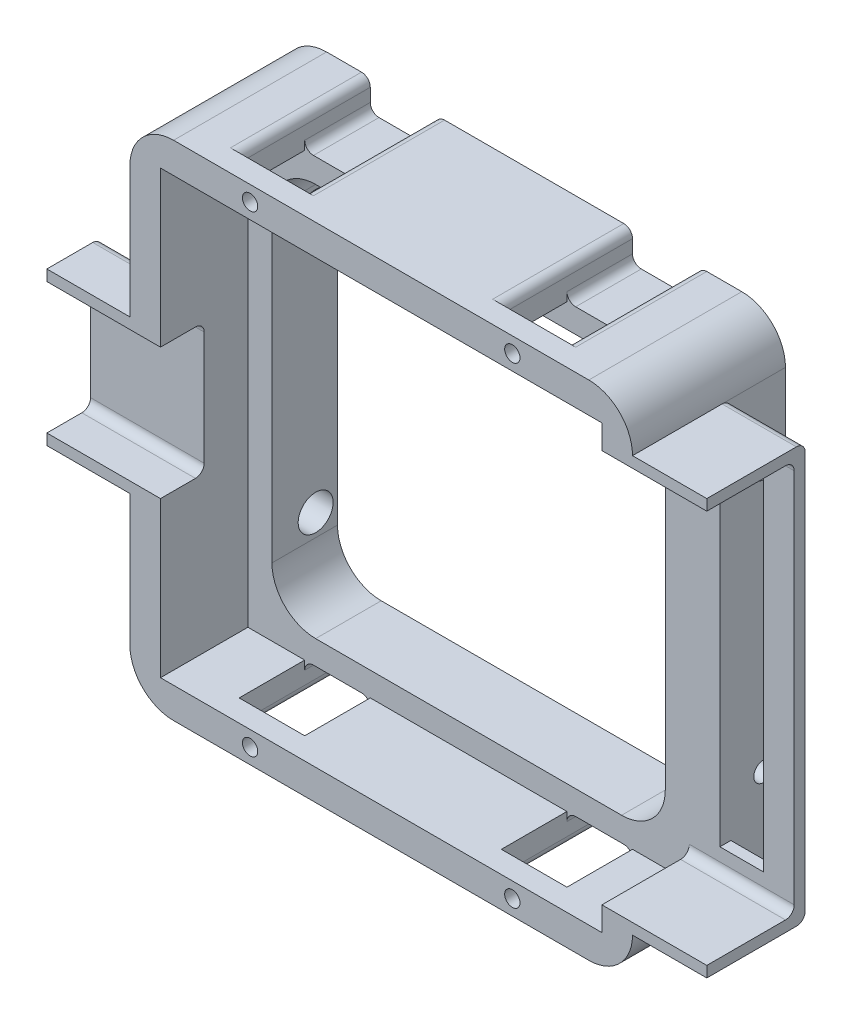
from build123d import *

# Parameters (mm, degrees)
SKETCH1_W                                  = 115
SKETCH1_H                                  = 115
BOSS_EXTRUDE1_DEPTH                        = 30
FILLET1_R                                  = 10
SKETCH4_W                                  = 101
SKETCH4_H                                  = 101
CUT_EXTRUDE3_DEPTH                         = 20
SKETCH7_W                                  = 90
SKETCH7_H                                  = 90
CUT_EXTRUDE5_DEPTH                         = 60
FILLET3_R                                  = 10
SKETCH8_R                                  = 3.15
CUT_EXTRUDE6_DEPTH                         = 35
MIRROR2_AT_THE_SECOND_PLANE_COPY_1_SKETC_R = 3.15
MIRROR2_AT_THE_SECOND_PLANE_COPY_1_DEPTH   = 35
SKETCH11_W                                 = 40
SKETCH11_H                                 = 90
CUT_EXTRUDE9_DEPTH                         = 11
SKETCH13_W                                 = 2.5
SKETCH13_H                                 = 90
BOSS_EXTRUDE2_DEPTH                        = 17
FILLET6_R                                  = 2
SKETCH14_W                                 = 20
SKETCH14_H                                 = 30
CUT_EXTRUDE10_DEPTH                        = 11
SKETCH15_W                                 = 10
SKETCH15_H                                 = 2.5
BOSS_EXTRUDE3_DEPTH                        = 19
FILLET7_R                                  = 2
SKETCH16_W                                 = 115
SKETCH16_H                                 = 115
CUT_EXTRUDE12_DEPTH                        = 25
SKETCH17_W                                 = 10
SKETCH17_H                                 = 80
CUT_EXTRUDE13_DEPTH                        = 15
SKETCH20_R                                 = 2.25
CUT_EXTRUDE14_DEPTH                        = 25
MIRROR8_AT_THE_SECOND_PLANE_COPY_1_SKETC_R = 2.25
MIRROR8_AT_THE_SECOND_PLANE_COPY_1_DEPTH   = 25
SKETCH21_R                                 = 1.75
CUT_EXTRUDE15_DEPTH                        = 20
MIRROR9_AT_THE_SECOND_PLANE_COPY_1_SKETC_R = 1.75
MIRROR9_AT_THE_SECOND_PLANE_COPY_1_DEPTH   = 20
SKETCH24_W                                 = 15
SKETCH24_H                                 = 25
CUT_EXTRUDE16_DEPTH                        = 7
MIRROR10_AT_THE_SECOND_PLANE_COPY_1_SKET_W = 15
MIRROR10_AT_THE_SECOND_PLANE_COPY_1_SKET_H = 25
MIRROR10_AT_THE_SECOND_PLANE_COPY_1_DEPTH  = 7
SKETCH25_R                                 = 4
CUT_EXTRUDE17_DEPTH                        = 7.5
MIRROR11_AT_THE_SECOND_PLANE_COPY_1_SKET_R = 4
MIRROR11_AT_THE_SECOND_PLANE_COPY_1_DEPTH  = 7.5
SKETCH28_W                                 = 15
SKETCH28_H                                 = 14
CUT_EXTRUDE20_DEPTH                        = 20
MIRROR12_AT_THE_SECOND_PLANE_COPY_1_SKET_W = 15
MIRROR12_AT_THE_SECOND_PLANE_COPY_1_SKET_H = 14
MIRROR12_AT_THE_SECOND_PLANE_COPY_1_DEPTH  = 20
FILLET8_R                                  = 2


with BuildPart() as part:
    # Sketch1 → Boss-Extrude1 (new, symmetric)
    with BuildSketch(Plane.XY):
        Rectangle(SKETCH1_W, SKETCH1_H)
    extrude(amount=BOSS_EXTRUDE1_DEPTH, both=True)

    # Fillet1
    fillet1_edges = [part.edges().sort_by_distance(p)[0] for p in [
        (-57.5, 57.5, 0),
        (57.5, 57.5, 0),
        (57.5, -57.5, 0),
        (-57.5, -57.5, 0),
    ]]
    fillet(fillet1_edges, radius=FILLET1_R)

    # Sketch4 → Cut-Extrude3 (cut)
    with BuildSketch(Plane.XY.offset(30)):
        Rectangle(SKETCH4_W, SKETCH4_H)
    extrude(amount=-CUT_EXTRUDE3_DEPTH, mode=Mode.SUBTRACT)

    # Sketch7 → Cut-Extrude5 (cut)
    with BuildSketch(Plane.XY.offset(10)):
        Rectangle(SKETCH7_W, SKETCH7_H)
    extrude(amount=-CUT_EXTRUDE5_DEPTH, mode=Mode.SUBTRACT)

    # Fillet3
    fillet3_edges = [part.edges().sort_by_distance(p)[0] for p in [
        (-45, -45, -10),
        (-45, 45, -10),
        (45, 45, -10),
        (45, -45, -10),
    ]]
    fillet(fillet3_edges, radius=FILLET3_R)

    # Sketch8 → Cut-Extrude6 (cut)
    with BuildSketch(Plane(origin=(0, 0, -30), x_dir=(-1, 0, 0), z_dir=(0, 0, -1))):
        with Locations((-48, 48)):
            Circle(SKETCH8_R)
    cut_extrude6 = extrude(amount=-CUT_EXTRUDE6_DEPTH, mode=Mode.SUBTRACT)

    # Mirror2: Cut-Extrude6 across plane
    add(cut_extrude6.mirror(Plane.ZX), mode=Mode.SUBTRACT)

    # Mirror2 at the second plane: Cut-Extrude6 across plane
    add(cut_extrude6.mirror(Plane(origin=(0, 0, 0), x_dir=(0, 0, 1), z_dir=(1, 0, 0))), mode=Mode.SUBTRACT)

    # Mirror2 at the second plane copy 1 sketc → Mirror2 at the second plane copy 1 (cut)
    with BuildSketch(Plane(origin=(0, 0, -30), x_dir=(1, 0, 0), z_dir=(0, 0, -1))):
        with Locations((-48, 48)):
            Circle(MIRROR2_AT_THE_SECOND_PLANE_COPY_1_SKETC_R)
    extrude(amount=-MIRROR2_AT_THE_SECOND_PLANE_COPY_1_DEPTH, mode=Mode.SUBTRACT)

    # Sketch11 → Cut-Extrude9 (cut)
    with BuildSketch(Plane(origin=(57.5, 0, 0), x_dir=(0, 0, -1), z_dir=(1, 0, 0))):
        with Locations((-30, 0)):
            Rectangle(SKETCH11_W, SKETCH11_H)
    extrude(amount=-CUT_EXTRUDE9_DEPTH, mode=Mode.SUBTRACT)

    # Sketch13 → Boss-Extrude2 (add)
    with BuildSketch(Plane(origin=(57.5, 0, 0), x_dir=(0, 0, -1), z_dir=(1, 0, 0))):
        with Locations((-8.75, 0)):
            Rectangle(SKETCH13_W, SKETCH13_H)
        Polygon((-7.5, -45), (-10, -45), (-30, -45), (-30, -47.5), (-7.5, -47.5), align=None)
        Polygon((-30, 45), (-10, 45), (-7.5, 45), (-7.5, 47.5), (-30, 47.5), align=None)
    extrude(amount=BOSS_EXTRUDE2_DEPTH)

    # Fillet6
    fillet6_edges = [part.edges().sort_by_distance(p)[0] for p in [
        (62.5, 45, 10),
        (62.5, -45, 10),
        (66, -47.5, 7.5),
        (66, 47.5, 7.5),
    ]]
    fillet(fillet6_edges, radius=FILLET6_R)

    # Sketch14 → Cut-Extrude10 (cut)
    with BuildSketch(Plane.ZY.offset(57.5)):
        with Locations((30, 0)):
            Rectangle(SKETCH14_W, SKETCH14_H)
    extrude(amount=-CUT_EXTRUDE10_DEPTH, mode=Mode.SUBTRACT)

    # Sketch15 → Boss-Extrude3 (add)
    with BuildSketch(Plane.ZY.offset(57.5)):
        Polygon((20, -15), (20, 15), (20, 17.5), (17.5, 17.5), (17.5, -17.5), (20, -17.5), align=None)
        with Locations((25, 16.25)):
            Rectangle(SKETCH15_W, SKETCH15_H)
        with Locations((25, -16.25)):
            Rectangle(SKETCH15_W, SKETCH15_H)
    extrude(amount=BOSS_EXTRUDE3_DEPTH)

    # Fillet7
    fillet7_edges = [part.edges().sort_by_distance(p)[0] for p in [
        (-63.5, -15, 20),
        (-63.5, 15, 20),
        (-67, 17.5, 17.5),
        (-67, -17.5, 17.5),
    ]]
    fillet(fillet7_edges, radius=FILLET7_R)

    # Sketch16 → Cut-Extrude12 (cut)
    with BuildSketch(Plane(origin=(0, 0, -30), x_dir=(-1, 0, 0), z_dir=(0, 0, -1))):
        Rectangle(SKETCH16_W, SKETCH16_H)
    extrude(amount=-CUT_EXTRUDE12_DEPTH, mode=Mode.SUBTRACT)

    # Sketch17 → Cut-Extrude13 (cut)
    with BuildSketch(Plane(origin=(0, 0, 7.5), x_dir=(-1, 0, 0), z_dir=(0, 0, -1))):
        with Locations((-62.5, 0)):
            Rectangle(SKETCH17_W, SKETCH17_H)
    extrude(amount=-CUT_EXTRUDE13_DEPTH, mode=Mode.SUBTRACT)

    # Sketch20 → Cut-Extrude14 (cut)
    with BuildSketch(Plane(origin=(57.5, 0, 0), x_dir=(0, 0, -1), z_dir=(1, 0, 0))):
        with Locations((0, 30)):
            Circle(SKETCH20_R)
    cut_extrude14 = extrude(amount=-CUT_EXTRUDE14_DEPTH, mode=Mode.SUBTRACT)

    # Mirror8: Cut-Extrude14 across plane
    add(cut_extrude14.mirror(Plane(origin=(0, 0, 0), x_dir=(0, 0, 1), z_dir=(1, 0, 0))), mode=Mode.SUBTRACT)

    # Mirror8 at the second plane: Cut-Extrude14 across plane
    add(cut_extrude14.mirror(Plane.ZX), mode=Mode.SUBTRACT)

    # Mirror8 at the second plane copy 1 sketc → Mirror8 at the second plane copy 1 (cut)
    with BuildSketch(Plane(origin=(-57.5, 0, 0), x_dir=(0, 0, -1), z_dir=(-1, 0, 0))):
        with Locations((0, 30)):
            Circle(MIRROR8_AT_THE_SECOND_PLANE_COPY_1_SKETC_R)
    extrude(amount=-MIRROR8_AT_THE_SECOND_PLANE_COPY_1_DEPTH, mode=Mode.SUBTRACT)

    # Sketch21 → Cut-Extrude15 (cut)
    with BuildSketch(Plane.XY.offset(30)):
        with Locations((30, 54)):
            Circle(SKETCH21_R)
    cut_extrude15 = extrude(amount=-CUT_EXTRUDE15_DEPTH, mode=Mode.SUBTRACT)

    # Mirror9: Cut-Extrude15 across plane
    add(cut_extrude15.mirror(Plane.ZX), mode=Mode.SUBTRACT)

    # Mirror9 at the second plane: Cut-Extrude15 across plane
    add(cut_extrude15.mirror(Plane(origin=(0, 0, 0), x_dir=(0, 0, 1), z_dir=(1, 0, 0))), mode=Mode.SUBTRACT)

    # Mirror9 at the second plane copy 1 sketc → Mirror9 at the second plane copy 1 (cut)
    with BuildSketch(Plane(origin=(0, 0, 30), x_dir=(-1, 0, 0), z_dir=(0, 0, 1))):
        with Locations((30, 54)):
            Circle(MIRROR9_AT_THE_SECOND_PLANE_COPY_1_SKETC_R)
    extrude(amount=-MIRROR9_AT_THE_SECOND_PLANE_COPY_1_DEPTH, mode=Mode.SUBTRACT)

    # Sketch24 → Cut-Extrude16 (cut)
    with BuildSketch(Plane(origin=(0, 57.5, 0), x_dir=(1, 0, 0), z_dir=(0, 1, 0))):
        with Locations((30, -12.5)):
            Rectangle(SKETCH24_W, SKETCH24_H)
    cut_extrude16 = extrude(amount=-CUT_EXTRUDE16_DEPTH, mode=Mode.SUBTRACT)

    # Mirror10: Cut-Extrude16 across plane
    add(cut_extrude16.mirror(Plane(origin=(0, 0, 0), x_dir=(0, 0, 1), z_dir=(1, 0, 0))), mode=Mode.SUBTRACT)

    # Mirror10 at the second plane: Cut-Extrude16 across plane
    add(cut_extrude16.mirror(Plane.ZX), mode=Mode.SUBTRACT)

    # Mirror10 at the second plane copy 1 sket → Mirror10 at the second plane copy 1 (cut)
    with BuildSketch(Plane(origin=(0, -57.5, 0), x_dir=(-1, 0, 0), z_dir=(0, -1, 0))):
        with Locations((30, -12.5)):
            Rectangle(MIRROR10_AT_THE_SECOND_PLANE_COPY_1_SKET_W, MIRROR10_AT_THE_SECOND_PLANE_COPY_1_SKET_H)
    extrude(amount=-MIRROR10_AT_THE_SECOND_PLANE_COPY_1_DEPTH, mode=Mode.SUBTRACT)

    # Sketch25 → Cut-Extrude17 (cut)
    with BuildSketch(Plane.ZY.offset(-45)):
        with Locations((0, 30)):
            Circle(SKETCH25_R)
    cut_extrude17 = extrude(amount=-CUT_EXTRUDE17_DEPTH, mode=Mode.SUBTRACT)

    # Mirror11: Cut-Extrude17 across plane
    add(cut_extrude17.mirror(Plane.ZX), mode=Mode.SUBTRACT)

    # Mirror11 at the second plane: Cut-Extrude17 across plane
    add(cut_extrude17.mirror(Plane(origin=(0, 0, 0), x_dir=(0, 0, 1), z_dir=(1, 0, 0))), mode=Mode.SUBTRACT)

    # Mirror11 at the second plane copy 1 sket → Mirror11 at the second plane copy 1 (cut)
    with BuildSketch(Plane(origin=(-45, 0, 0), x_dir=(0, 0, 1), z_dir=(1, 0, 0))):
        with Locations((0, 30)):
            Circle(MIRROR11_AT_THE_SECOND_PLANE_COPY_1_SKET_R)
    extrude(amount=-MIRROR11_AT_THE_SECOND_PLANE_COPY_1_DEPTH, mode=Mode.SUBTRACT)

    # Sketch28 → Cut-Extrude20 (cut)
    with BuildSketch(Plane(origin=(0, 0, -5), x_dir=(-1, 0, 0), z_dir=(0, 0, -1))):
        with Locations((-30, 57.5)):
            Rectangle(SKETCH28_W, SKETCH28_H)
    cut_extrude20 = extrude(amount=-CUT_EXTRUDE20_DEPTH, mode=Mode.SUBTRACT)

    # Mirror12: Cut-Extrude20 across plane
    add(cut_extrude20.mirror(Plane.ZX), mode=Mode.SUBTRACT)

    # Mirror12 at the second plane: Cut-Extrude20 across plane
    add(cut_extrude20.mirror(Plane(origin=(0, 0, 0), x_dir=(0, 0, 1), z_dir=(1, 0, 0))), mode=Mode.SUBTRACT)

    # Mirror12 at the second plane copy 1 sket → Mirror12 at the second plane copy 1 (cut)
    with BuildSketch(Plane(origin=(0, 0, -5), x_dir=(1, 0, 0), z_dir=(0, 0, -1))):
        with Locations((-30, 57.5)):
            Rectangle(MIRROR12_AT_THE_SECOND_PLANE_COPY_1_SKET_W, MIRROR12_AT_THE_SECOND_PLANE_COPY_1_SKET_H)
    extrude(amount=-MIRROR12_AT_THE_SECOND_PLANE_COPY_1_DEPTH, mode=Mode.SUBTRACT)

    # Fillet8
    fillet8_edges = [part.edges().sort_by_distance(p)[0] for p in [
        (37.5, 50.5, 2.5),
        (22.5, 50.5, 2.5),
        (37.5, 57.5, 10),
        (22.5, 57.5, 10),
        (37.5, -57.5, 10),
        (22.5, -57.5, 10),
        (22.5, -50.5, 2.5),
        (37.5, -50.5, 2.5),
        (-37.5, 57.5, 10),
        (-22.5, 57.5, 10),
        (-22.5, 50.5, 2.5),
        (-37.5, 50.5, 2.5),
        (-37.5, -50.5, 2.5),
        (-22.5, -50.5, 2.5),
        (-37.5, -57.5, 10),
        (-22.5, -57.5, 10),
    ]]
    fillet(fillet8_edges, radius=FILLET8_R)


solid = part.part
